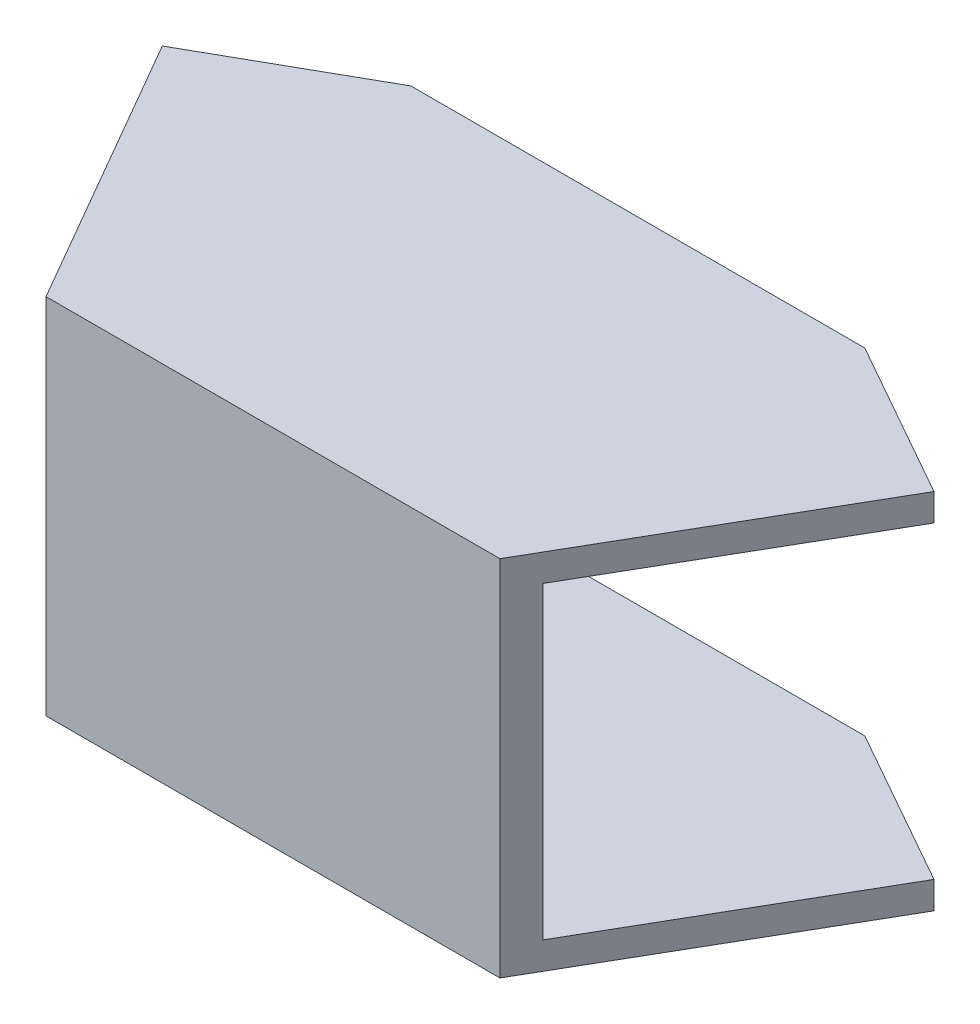
from build123d import *

# Parameters (mm, degrees)
EXTRUDE_1_DEPTH = 40
SHELL_1_T       = -3


with BuildPart() as part:
    # 草图1 → 凸台-拉伸1 (new body)
    with BuildSketch(Plane(origin=(0, 0, 0), x_dir=(1, 0, 0), z_dir=(0, 1, 0))):
        Polygon((-25, -16.701458194), (25, -16.701458194), (42.5, 13.609430939), (25, 23.487817083), (-25, 23.487817083), (-42.5, 13.609430939), align=None)
    extrude(amount=EXTRUDE_1_DEPTH)

    # 抽壳1
    shell_1_openings = [part.faces().sort_by_distance(p)[0] for p in [
        (-33.75, 20, -18.548624011),
        (0, 20, -23.487817083),
        (33.75, 20, -18.548624011),
        (33.75, 20, 1.546013628),
        (-33.75, 20, 1.546013628),
    ]]
    offset(amount=SHELL_1_T, openings=shell_1_openings, kind=Kind.INTERSECTION)


solid = part.part
